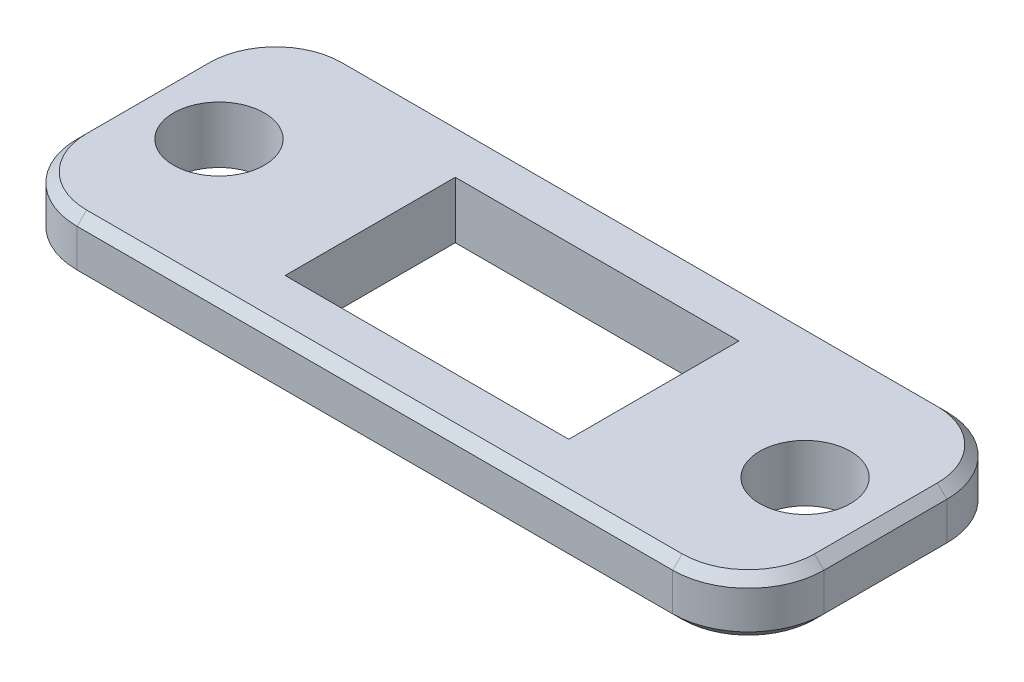
from build123d import *

# Parameters (mm, degrees)
SKETCH1_W            = 39.5
SKETCH1_H            = 14.5
SKETCH1_W_2          = 15
SKETCH1_H_2          = 9
BOSS_EXTRUDE1_DEPTH  = 3
FILLET1_R            = 4
M4_CLEARANCE_HOLE1_D = 4.8
CHAMFER1_SIZE        = 0.5


with BuildPart() as part:
    # Sketch1 → Boss-Extrude1 (new body)
    with BuildSketch(Plane(origin=(0, 0, 0), x_dir=(1, 0, 0), z_dir=(0, 1, 0))):
        Rectangle(SKETCH1_W, SKETCH1_H)
        Rectangle(SKETCH1_W_2, SKETCH1_H_2, mode=Mode.SUBTRACT)
    extrude(amount=BOSS_EXTRUDE1_DEPTH)

    # Fillet1
    fillet1_edges = [part.edges().sort_by_distance(p)[0] for p in [
        (19.75, 1.5, 7.25),
        (-19.75, 1.5, 7.25),
        (-19.75, 1.5, -7.25),
        (19.75, 1.5, -7.25),
    ]]
    fillet(fillet1_edges, radius=FILLET1_R)

    # M4 Clearance Hole1 (through all)
    with Locations(Plane(origin=(0, 3, 0), x_dir=(1, 0, 0), z_dir=(0, 1, 0))):
        with Locations((-15.5, 0), (15.5, 0)):
            Hole(M4_CLEARANCE_HOLE1_D / 2)

    # Chamfer1
    chamfer1_edges = [part.edges().sort_by_distance(p)[0] for p in [
        (19.75, 0, 0),
        (19.75, 3, 0),
        (0, 0, 7.25),
        (-19.75, 0, 0),
        (0, 0, -7.25),
        (-18.578427125, 0, -6.078427125),
        (-18.578427125, 0, 6.078427125),
        (18.578427125, 0, -6.078427125),
        (18.578427125, 0, 6.078427125),
        (0, 3, 7.25),
        (0, 3, -7.25),
        (-19.75, 3, 0),
        (-18.578427125, 3, -6.078427125),
        (-18.578427125, 3, 6.078427125),
        (18.578427125, 3, -6.078427125),
        (18.578427125, 3, 6.078427125),
    ]]
    chamfer(chamfer1_edges, length=CHAMFER1_SIZE)


solid = part.part
